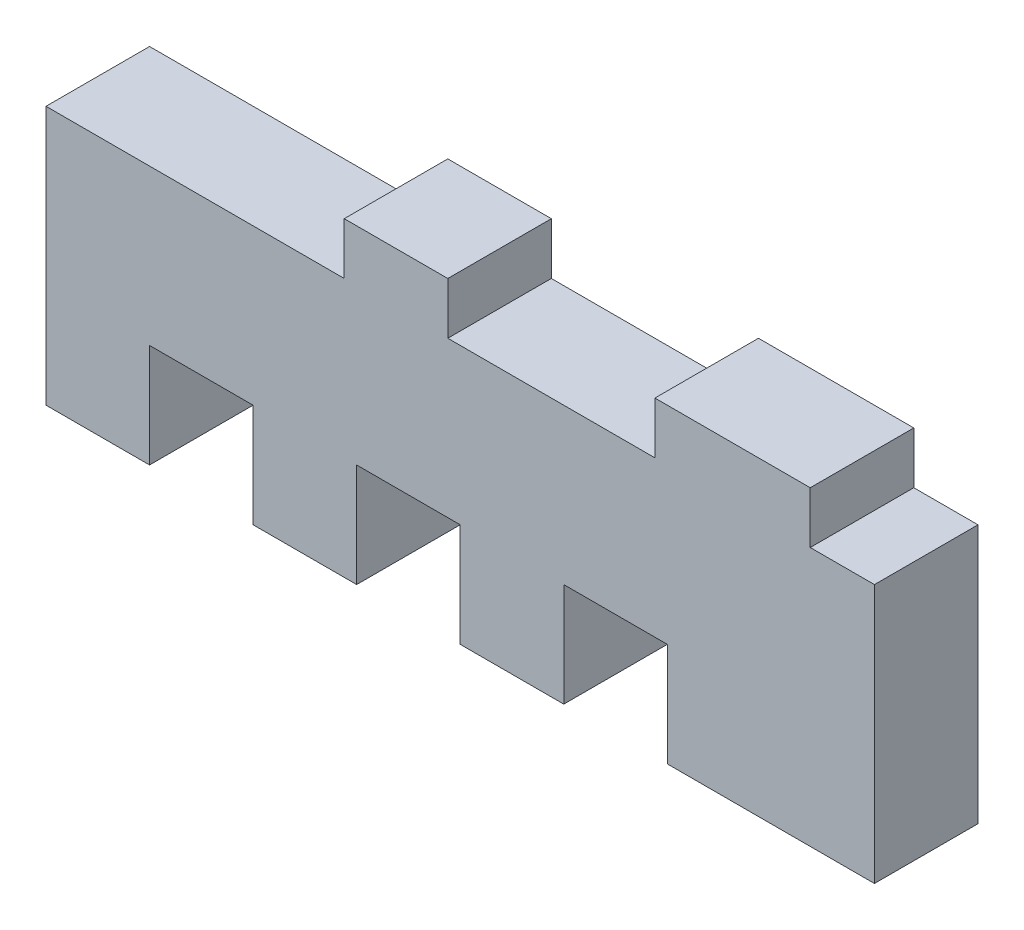
from build123d import *

# Parameters (mm, degrees)
BOSS_EXTRUDE1_DEPTH = 12.7


with BuildPart() as part:
    # Sketch1 → Boss-Extrude1 (new body)
    with BuildSketch(Plane.XY):
        Polygon((0, 0), (36.576, 0), (36.576, 6.35), (49.276, 6.35), (49.276, 0), (74.676, 0), (74.676, 6.35), (93.726, 6.35), (93.726, 0), (101.6, 0), (101.6, -31.75), (76.2, -31.75), (76.2, -19.05), (63.5, -19.05), (63.5, -31.75), (50.8, -31.75), (50.8, -19.05), (38.1, -19.05), (38.1, -31.75), (25.4, -31.75), (25.4, -19.05), (12.7, -19.05), (12.7, -31.75), (0, -31.75), align=None)
    extrude(amount=BOSS_EXTRUDE1_DEPTH)


solid = part.part
